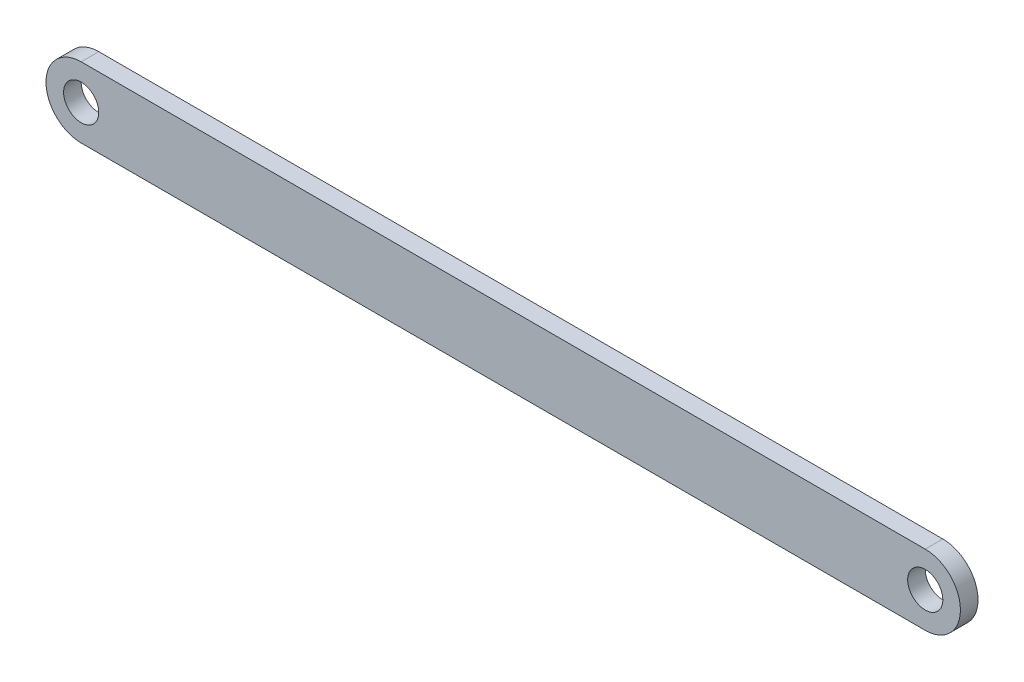
from build123d import *

# Parameters (mm, degrees)
SKETCH1_R           = 31.75
BOSS_EXTRUDE1_DEPTH = 15.875


with BuildPart() as part:
    # Sketch1 → Boss-Extrude1 (new, symmetric)
    with BuildSketch(Plane.XY):
        with BuildLine():
            Line((-762, 63.657439452), (762, 63.657439452))
            ThreePointArc((762, 63.657439452), (825.5, 0.157439452), (762, -63.342560548))
            Line((762, -63.342560548), (-762, -63.342560548))
            ThreePointArc((-762, -63.342560548), (-825.5, 0.157439452), (-762, 63.657439452))
        make_face()
        with Locations((-762, 0.157439452)):
            Circle(SKETCH1_R, mode=Mode.SUBTRACT)
        with Locations((762, 0.157439452)):
            Circle(SKETCH1_R, mode=Mode.SUBTRACT)
    extrude(amount=BOSS_EXTRUDE1_DEPTH, both=True)


solid = part.part
